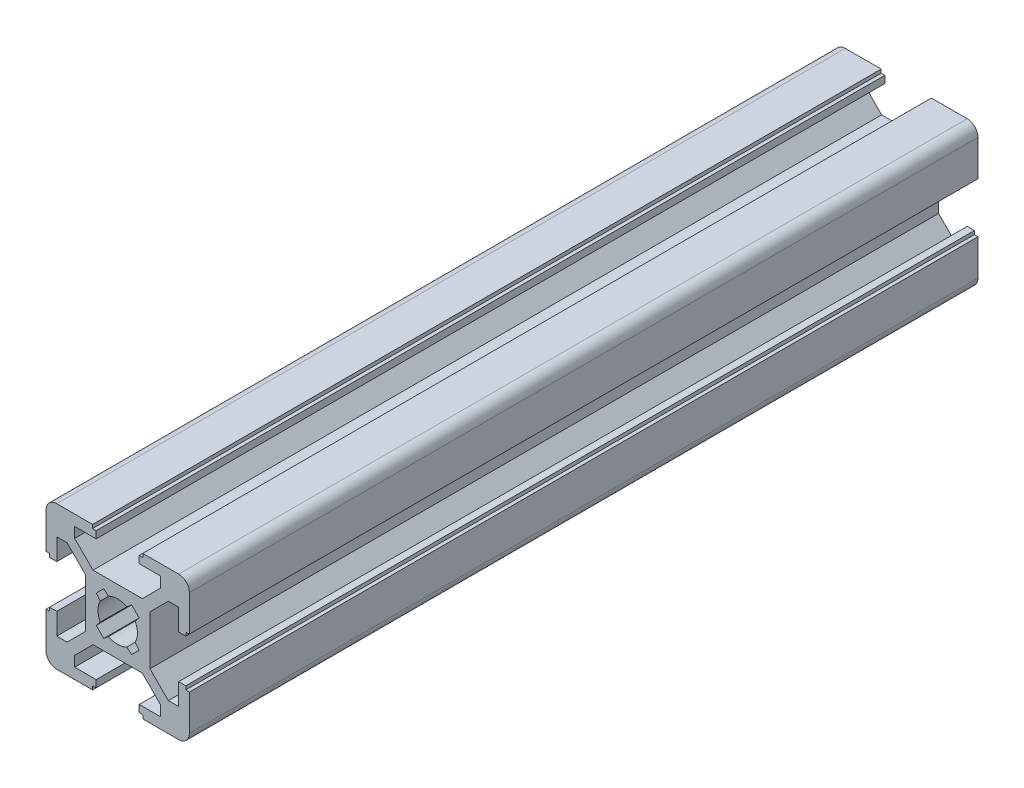
from build123d import *

# Parameters (mm, degrees)
AUFSATZ_LINEAR_AUSTRAGEN1_DEPTH = 110


with BuildPart() as part:
    # Skizze1 → Aufsatz-Linear austragen1 (new body)
    with BuildSketch(Plane.XY):
        with BuildLine():
            Line((9.896623228, -8.686160957), (9.896623228, -3.686160957))
            Line((9.896623228, -3.686160957), (9.396623228, -3.686160957))
            Line((9.396623228, -3.686160957), (9.396623228, -3.186160957))
            Line((9.396623228, -3.186160957), (8.396623228, -3.186160957))
            Line((8.396623228, -3.186160957), (8.396623228, -6.186160957))
            Line((8.396623228, -6.186160957), (6.957283398, -6.186160957))
            Line((6.957283398, -6.186160957), (4.396623228, -3.625500787))
            Line((4.396623228, -3.625500787), (4.396623228, 3.253178873))
            Line((4.396623228, 3.253178873), (6.957283398, 5.813839043))
            Line((6.957283398, 5.813839043), (8.396623228, 5.813839043))
            Line((8.396623228, 5.813839043), (8.396623228, 2.813839043))
            Line((8.396623228, 2.813839043), (9.396623228, 2.813839043))
            Line((9.396623228, 2.813839043), (9.396623228, 3.313839043))
            Line((9.396623228, 3.313839043), (9.896623228, 3.313839043))
            Line((9.896623228, 3.313839043), (9.896623228, 8.313839043))
            ThreePointArc((9.896623228, 8.313839043), (9.457283398, 9.374499213), (8.396623228, 9.813839043))
            Line((8.396623228, 9.813839043), (3.396623228, 9.813839043))
            Line((3.396623228, 9.813839043), (3.396623228, 9.313839043))
            Line((3.396623228, 9.313839043), (2.896623228, 9.313839043))
            Line((2.896623228, 9.313839043), (2.896623228, 8.313839043))
            Line((2.896623228, 8.313839043), (5.896623228, 8.313839043))
            Line((5.896623228, 8.313839043), (5.896623228, 6.874499213))
            Line((5.896623228, 6.874499213), (3.335963058, 4.313839043))
            Line((3.335963058, 4.313839043), (-3.542716602, 4.313839043))
            Line((-3.542716602, 4.313839043), (-6.103376772, 6.874499213))
            Line((-6.103376772, 6.874499213), (-6.103376772, 8.313839043))
            Line((-6.103376772, 8.313839043), (-3.103376772, 8.313839043))
            Line((-3.103376772, 8.313839043), (-3.103376772, 9.313839043))
            Line((-3.103376772, 9.313839043), (-3.603376772, 9.313839043))
            Line((-3.603376772, 9.313839043), (-3.603376772, 9.813839043))
            Line((-3.603376772, 9.813839043), (-8.603376772, 9.813839043))
            ThreePointArc((-8.603376772, 9.813839043), (-9.664036942, 9.374499213), (-10.103376772, 8.313839043))
            Line((-10.103376772, 8.313839043), (-10.103376772, 3.313839043))
            Line((-10.103376772, 3.313839043), (-9.603376772, 3.313839043))
            Line((-9.603376772, 3.313839043), (-9.603376772, 2.813839043))
            Line((-9.603376772, 2.813839043), (-8.603376772, 2.813839043))
            Line((-8.603376772, 2.813839043), (-8.603376772, 5.813839043))
            Line((-8.603376772, 5.813839043), (-7.164036942, 5.813839043))
            Line((-7.164036942, 5.813839043), (-4.603376772, 3.253178873))
            Line((-4.603376772, 3.253178873), (-4.603376772, -3.625500787))
            Line((-4.603376772, -3.625500787), (-7.164036942, -6.186160957))
            Line((-7.164036942, -6.186160957), (-8.603376772, -6.186160957))
            Line((-8.603376772, -6.186160957), (-8.603376772, -3.186160957))
            Line((-8.603376772, -3.186160957), (-9.603376772, -3.186160957))
            Line((-9.603376772, -3.186160957), (-9.603376772, -3.686160957))
            Line((-9.603376772, -3.686160957), (-10.103376772, -3.686160957))
            Line((-10.103376772, -3.686160957), (-10.103376772, -8.686160957))
            ThreePointArc((-10.103376772, -8.686160957), (-9.664036942, -9.746821127), (-8.603376772, -10.186160957))
            Line((-8.603376772, -10.186160957), (-3.603376772, -10.186160957))
            Line((-3.603376772, -10.186160957), (-3.603376772, -9.686160957))
            Line((-3.603376772, -9.686160957), (-3.103376772, -9.686160957))
            Line((-3.103376772, -9.686160957), (-3.103376772, -8.686160957))
            Line((-3.103376772, -8.686160957), (-6.103376772, -8.686160957))
            Line((-6.103376772, -8.686160957), (-6.103376772, -7.246821127))
            Line((-6.103376772, -7.246821127), (-3.542716602, -4.686160957))
            Line((-3.542716602, -4.686160957), (3.335963058, -4.686160957))
            Line((3.335963058, -4.686160957), (5.896623228, -7.246821127))
            Line((5.896623228, -7.246821127), (5.896623228, -8.686160957))
            Line((5.896623228, -8.686160957), (2.896623228, -8.686160957))
            Line((2.896623228, -8.686160957), (2.896623228, -9.686160957))
            Line((2.896623228, -9.686160957), (3.396623228, -9.686160957))
            Line((3.396623228, -9.686160957), (3.396623228, -10.186160957))
            Line((3.396623228, -10.186160957), (8.396623228, -10.186160957))
            ThreePointArc((8.396623228, -10.186160957), (9.457283398, -9.746821127), (9.896623228, -8.686160957))
        make_face()
        with BuildLine():
            Line((-2.539013132, 1.090622313), (-3.103550972, 1.763412313))
            Line((-3.103550972, 1.763412313), (-2.052950042, 2.814013243))
            Line((-2.052950042, 2.814013243), (-1.380160042, 2.249475403))
            ThreePointArc((-1.380160042, 2.249475403), (-0.103376772, 2.563839041), (1.173406498, 2.249475399))
            Line((1.173406498, 2.249475399), (1.846196498, 2.814013239))
            Line((1.846196498, 2.814013239), (2.896797428, 1.763412309))
            Line((2.896797428, 1.763412309), (2.332259586, 1.09062231))
            ThreePointArc((2.332259586, 1.09062231), (2.646623225, -0.186160958), (2.332259587, -1.462944226))
            Line((2.332259587, -1.462944226), (2.896797427, -2.135734226))
            Line((2.896797427, -2.135734226), (1.846196497, -3.186335156))
            Line((1.846196497, -3.186335156), (1.173406497, -2.621797316))
            ThreePointArc((1.173406497, -2.621797316), (-0.103376773, -2.936160957), (-1.380160043, -2.62179732))
            Line((-1.380160043, -2.62179732), (-2.052950043, -3.18633516))
            Line((-2.052950043, -3.18633516), (-3.103550973, -2.13573423))
            Line((-3.103550973, -2.13573423), (-2.539013133, -1.46294423))
            ThreePointArc((-2.539013133, -1.46294423), (-2.853376773, -0.186160958), (-2.539013132, 1.090622313))
        make_face(mode=Mode.SUBTRACT)
    extrude(amount=AUFSATZ_LINEAR_AUSTRAGEN1_DEPTH)


solid = part.part
